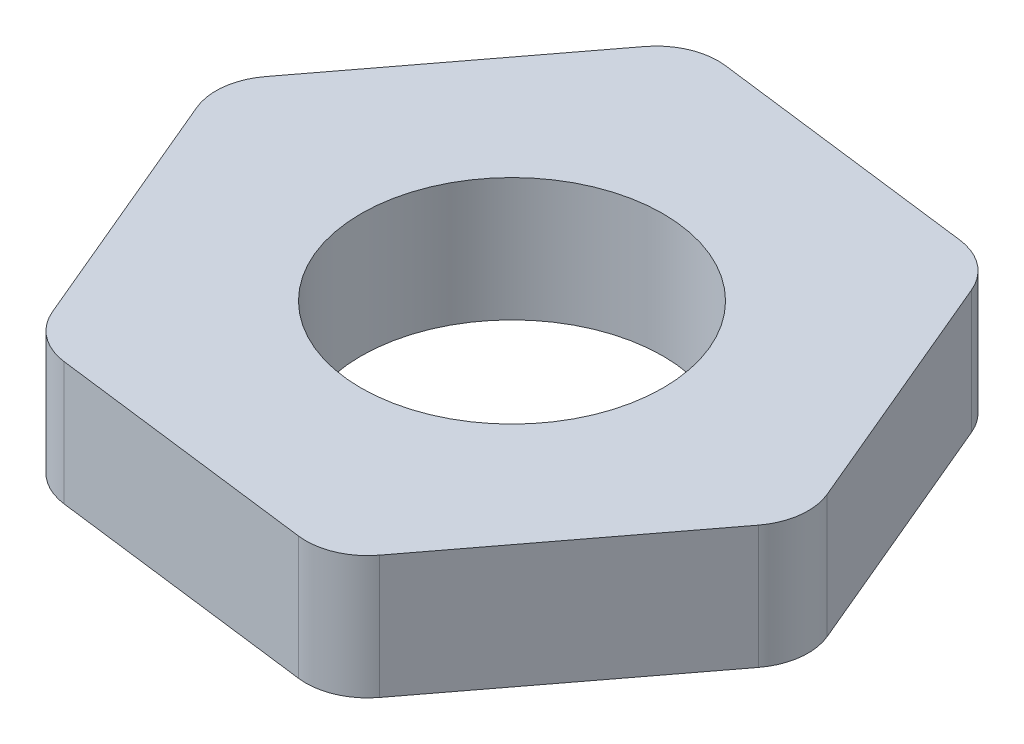
from build123d import *

# Parameters (mm, degrees)
SKETCH1_R           = 1.225
BOSS_EXTRUDE1_DEPTH = 1
FILLET1_R           = 0.5


with BuildPart() as part:
    # Sketch1 → Boss-Extrude1 (new body)
    with BuildSketch(Plane(origin=(0, 0, 0), x_dir=(1, 0, 0), z_dir=(0, 1, 0))):
        Polygon((-1.074509741, 2.55449189), (-2.749509741, 0.346693213), (-1.675, -2.207798677), (1.074509741, -2.55449189), (2.749509741, -0.346693213), (1.675, 2.207798677), align=None)
        with Locations(Location((0, 0, 0), (0, 0, 270))):
            Circle(SKETCH1_R, mode=Mode.SUBTRACT)
    extrude(amount=BOSS_EXTRUDE1_DEPTH)

    # Fillet1
    fillet1_edges = [part.edges().sort_by_distance(p)[0] for p in [
        (1.675, 0.5, -2.207798677),
        (2.749509741, 0.5, 0.346693213),
        (1.074509741, 0.5, 2.55449189),
        (-1.675, 0.5, 2.207798677),
        (-2.749509741, 0.5, -0.346693213),
        (-1.074509741, 0.5, -2.55449189),
    ]]
    fillet(fillet1_edges, radius=FILLET1_R)


solid = part.part
